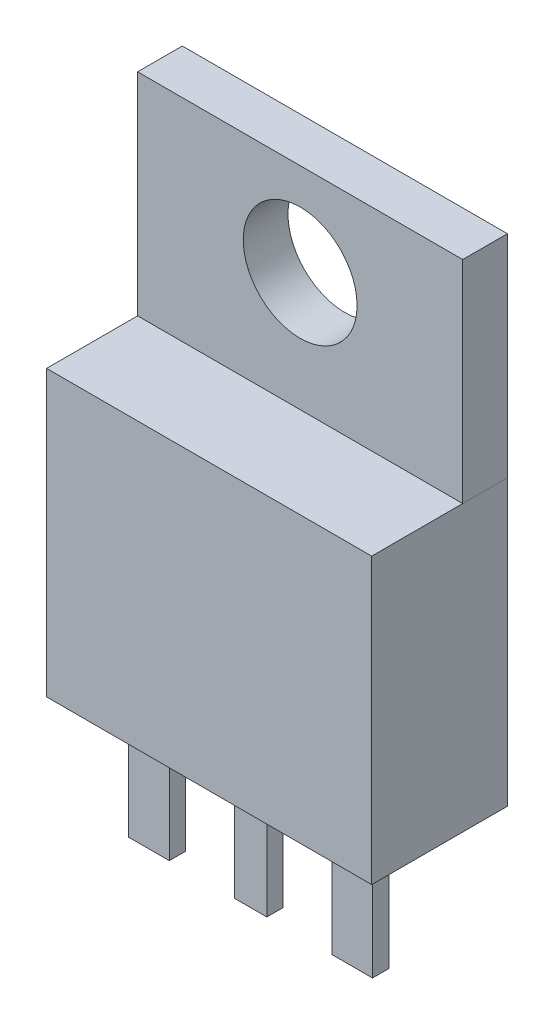
from build123d import *

# Parameters (mm, degrees)
SKETCH2_W             = 10.16
SKETCH2_H             = 6.604
SKETCH2_W_2           = 7.62
SKETCH2_H_2           = 5.842
BOSS_EXTRUDE1_DEPTH   = 1.397
SKETCH3_R             = 1.778
CUT_EXTRUDE1_DEPTH    = 11.553233865
SKETCH4_W             = 10.16
SKETCH4_H             = 8.89
BOSS_EXTRUDE2_DEPTH   = 4.2418
SKETCH7_W             = 7.62
SKETCH7_H             = 5.842
CUT_EXTRUDE3_DEPTH    = 1.397
SKETCH8_W             = 1.27
SKETCH8_H             = 0.508
BOSS_EXTRUDE3_DEPTH   = 3.81
BOSS_EXTRUDE3_2_DEPTH = 3.81
SKETCH8_W_2           = 1.016
BOSS_EXTRUDE3_3_DEPTH = 3.81


with BuildPart() as part:
    # Sketch2 → Boss-Extrude1 (new body)
    with BuildSketch(Plane.XY):
        Rectangle(SKETCH2_W, SKETCH2_H)
        with Locations((0, -6.223)):
            Rectangle(SKETCH2_W_2, SKETCH2_H_2)
    extrude(amount=BOSS_EXTRUDE1_DEPTH)

    # Sketch3 → Cut-Extrude1 (cut, through all)
    with BuildSketch(Plane.XY.offset(1.397)):
        with Locations((0, 0.4064)):
            Circle(SKETCH3_R)
    extrude(amount=-CUT_EXTRUDE1_DEPTH, mode=Mode.SUBTRACT)


with BuildPart() as body_2:
    # Sketch4 → Boss-Extrude2 (new body)
    with BuildSketch(Plane.XY):
        with Locations((0, -7.747)):
            Rectangle(SKETCH4_W, SKETCH4_H)
    extrude(amount=BOSS_EXTRUDE2_DEPTH)

    # Sketch7 → Cut-Extrude3 (cut)
    with BuildSketch(Plane(origin=(0, 0, 0), x_dir=(-1, 0, 0), z_dir=(0, 0, -1))):
        with Locations((0, -6.223)):
            Rectangle(SKETCH7_W, SKETCH7_H)
    extrude(amount=-CUT_EXTRUDE3_DEPTH, mode=Mode.SUBTRACT)


with BuildPart() as body_3:
    # Sketch8 → Boss-Extrude3 (new body)
    with BuildSketch(Plane.XZ.offset(12.192)):
        with Locations((-3.175, 2.6924)):
            Rectangle(SKETCH8_W, SKETCH8_H)
    extrude(amount=BOSS_EXTRUDE3_DEPTH)


with BuildPart() as body_4:
    # Sketch8 → Boss-Extrude3 2 (new body)
    with BuildSketch(Plane.XZ.offset(12.192)):
        with Locations((3.175, 2.6924)):
            Rectangle(SKETCH8_W, SKETCH8_H)
    extrude(amount=BOSS_EXTRUDE3_2_DEPTH)


with BuildPart() as body_5:
    # Sketch8 → Boss-Extrude3 3 (new body)
    with BuildSketch(Plane.XZ.offset(12.192)):
        with Locations((0, 2.6924)):
            Rectangle(SKETCH8_W_2, SKETCH8_H)
    extrude(amount=BOSS_EXTRUDE3_3_DEPTH)


solid = Compound([part.part, body_2.part, body_3.part, body_4.part, body_5.part])
